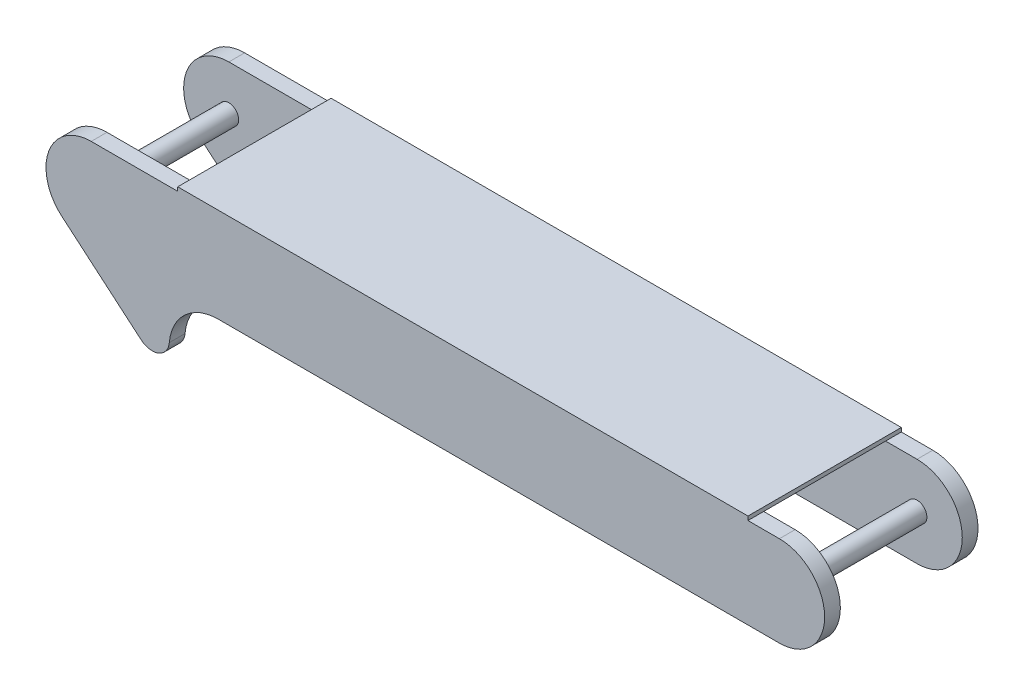
from build123d import *

# Parameters (mm, degrees)
SALIENTE_EXTRUIR1_DEPTH = 8
SALIENTE_EXTRUIR2_DEPTH = 8
CROQUIS3_W              = 290
CROQUIS3_H              = 78
SALIENTE_EXTRUIR3_DEPTH = 2
SALIENTE_EXTRUIR4_REACH = 385.299
CROQUIS4_R              = 5
SALIENTE_EXTRUIR5_REACH = 385.299
CROQUIS5_R              = 5


with BuildPart() as part:
    # Croquis1 → Saliente-Extruir1 (new body)
    with BuildSketch(Plane.XY.offset(39)):
        with BuildLine():
            Line((-14.882678763, -17.53584537), (25.33811134, -51.671245521))
            ThreePointArc((25.33811134, -51.671245521), (34.318759969, -53.096192455), (39.715363545, -45.777777778))
            ThreePointArc((39.715363545, -45.777777778), (47.742688304, -29.553380316), (64.616402247, -23))
            Line((64.616402247, -23), (350, -23))
            ThreePointArc((350, -23), (373, 0), (350, 23))
            Line((350, 23), (0, 23))
            ThreePointArc((0, 23), (-21.590790207, 7.927028336), (-14.882678763, -17.53584537))
        make_face()
    extrude(amount=-SALIENTE_EXTRUIR1_DEPTH)



with BuildPart() as body_2:
    # Croquis2 → Saliente-Extruir2 (new body)
    with BuildSketch(Plane.XY.offset(-39)):
        with BuildLine():
            Line((-14.882678763, -17.53584537), (25.33811134, -51.671245521))
            ThreePointArc((25.33811134, -51.671245521), (34.318759969, -53.096192455), (39.715363545, -45.777777778))
            ThreePointArc((39.715363545, -45.777777778), (47.742688304, -29.553380316), (64.616402247, -23))
            Line((64.616402247, -23), (350, -23))
            ThreePointArc((350, -23), (373, 0), (350, 23))
            Line((350, 23), (0, 23))
            ThreePointArc((0, 23), (-21.590790207, 7.927028336), (-14.882678763, -17.53584537))
        make_face()
    extrude(amount=SALIENTE_EXTRUIR2_DEPTH)


with BuildPart() as part_1:
    add(part.part)

    add(body_2.part)  # Saliente-Extruir3 merges body 2
    # Croquis3 → Saliente-Extruir3 (add)
    with BuildSketch(Plane(origin=(0, 23, 0), x_dir=(1, 0, 0), z_dir=(0, 1, 0))):
        with Locations((189, 0)):
            Rectangle(CROQUIS3_W, CROQUIS3_H)
    extrude(amount=SALIENTE_EXTRUIR3_DEPTH)

    # Croquis4 → Saliente-Extruir4 (add, up to next)
    with BuildSketch(Plane.XY.offset(-31), mode=Mode.PRIVATE) as saliente_extruir4_sk1:
        Circle(CROQUIS4_R)
    saliente_extruir4_tool1 = extrude(saliente_extruir4_sk1.sketch, amount=SALIENTE_EXTRUIR4_REACH, mode=Mode.PRIVATE) - part_1.part
    add(saliente_extruir4_tool1.solids().sort_by_distance((0, 0, -31))[0])

    # Croquis5 → Saliente-Extruir5 (add, up to next)
    with BuildSketch(Plane(origin=(0, 0, 31), x_dir=(-1, 0, 0), z_dir=(0, 0, -1)), mode=Mode.PRIVATE) as saliente_extruir5_sk1:
        with Locations(Location((-350, 0, 0), (0, 0, 180))):
            Circle(CROQUIS5_R)
    saliente_extruir5_tool1 = extrude(saliente_extruir5_sk1.sketch, amount=SALIENTE_EXTRUIR5_REACH, mode=Mode.PRIVATE) - part_1.part
    add(saliente_extruir5_tool1.solids().sort_by_distance((350, 0, 31))[0])


solid = part_1.part
